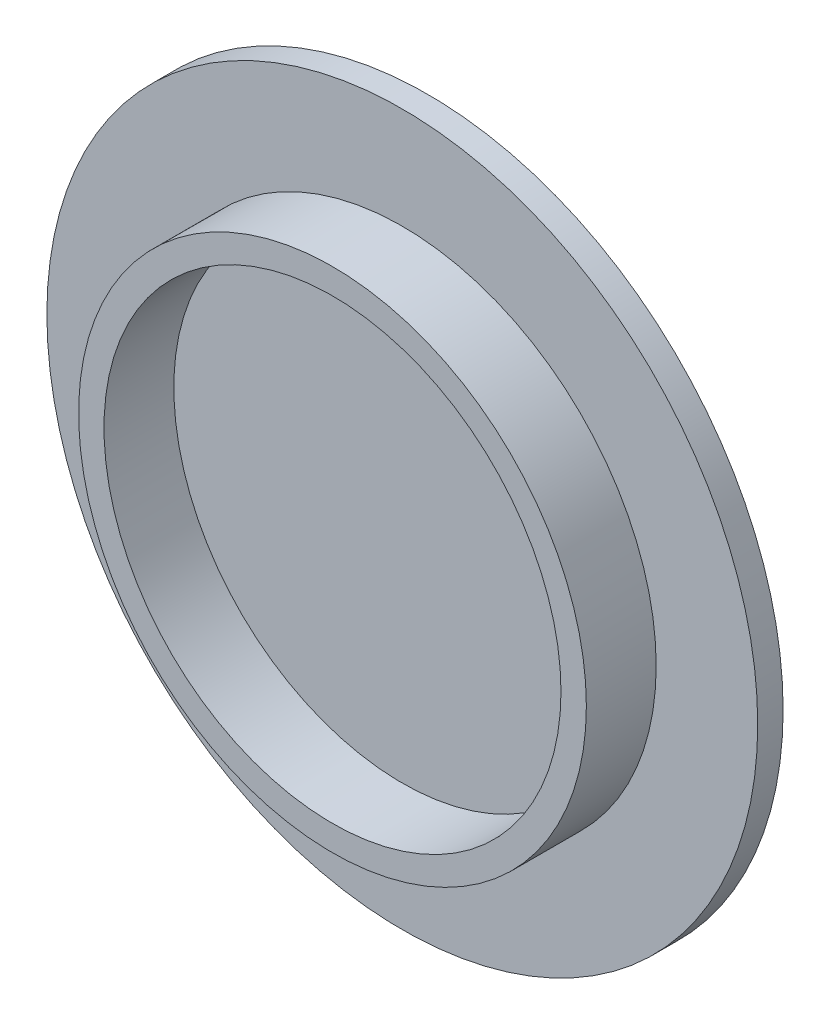
from build123d import *

# Parameters (mm, degrees)
SKETCH_1_R      = 140
EXTRUDE_1_DEPTH = 10
SKETCH_2_R      = 100
SKETCH_2_R_2    = 90
EXTRUDE_2_DEPTH = 27.5


with BuildPart() as part:
    # 草图1 → 拉伸1 (new body)
    with BuildSketch(Plane.XY):
        Circle(SKETCH_1_R)
    extrude(amount=EXTRUDE_1_DEPTH)

    # 草图2 → 拉伸2 (add)
    with BuildSketch(Plane.XY.offset(10)):
        Circle(SKETCH_2_R)
        Circle(SKETCH_2_R_2, mode=Mode.SUBTRACT)
    extrude(amount=EXTRUDE_2_DEPTH)


solid = part.part
